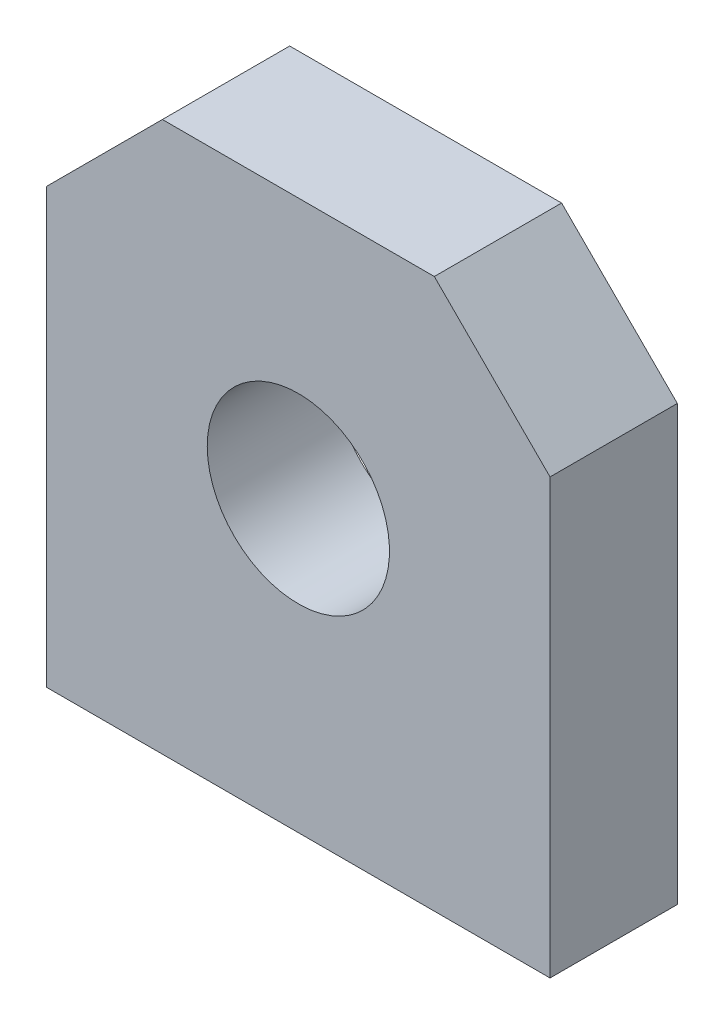
from build123d import *

# Parameters (mm, degrees)
BASE_DEPTH     = 2.794
SKETCH2_R      = 2
BASEHOLE_DEPTH = 2.794


with BuildPart() as part:
    # Sketch1 → Base (new body)
    with BuildSketch(Plane.XY):
        Polygon((-5.5245, 3.4925), (-2.9845, 6.0325), (2.9845, 6.0325), (5.5245, 3.4925), (5.5245, -6.0325), (-5.5245, -6.0325), align=None)
    extrude(amount=BASE_DEPTH)

    # Sketch2 → BaseHole (cut)
    with BuildSketch(Plane(origin=(0, 0, 0), x_dir=(-1, 0, 0), z_dir=(0, 0, -1))):
        with Locations((0, 0.3175)):
            Circle(SKETCH2_R)
    extrude(amount=-BASEHOLE_DEPTH, mode=Mode.SUBTRACT)


solid = part.part
